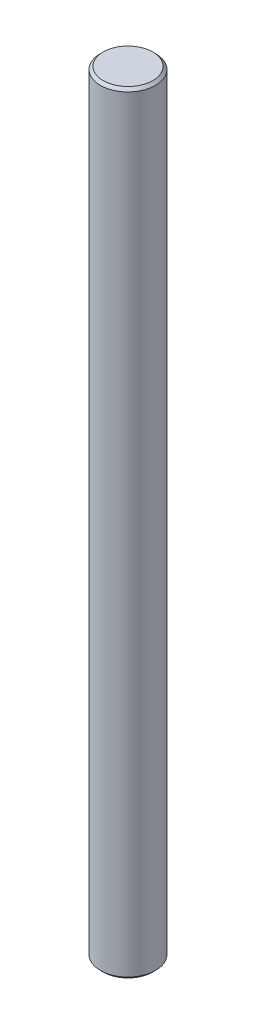
from build123d import *

# Parameters (mm, degrees)
SKETCH1_R           = 2.5
BOSS_EXTRUDE1_DEPTH = 35
CHAMFER1_SIZE       = 0.25


with BuildPart() as part:
    # Sketch1 → Boss-Extrude1 (new, symmetric)
    with BuildSketch(Plane(origin=(0, 0, 0), x_dir=(1, 0, 0), z_dir=(0, 1, 0))):
        with Locations(Location((0, 0, 0), (0, 0, 270))):
            Circle(SKETCH1_R)
    extrude(amount=BOSS_EXTRUDE1_DEPTH, both=True)

    # Chamfer1
    chamfer1_edges = [part.edges().sort_by_distance(p)[0] for p in [
        (0, -35, -2.5),
        (0, 35, -2.5),
    ]]
    chamfer(chamfer1_edges, length=CHAMFER1_SIZE)


solid = part.part
